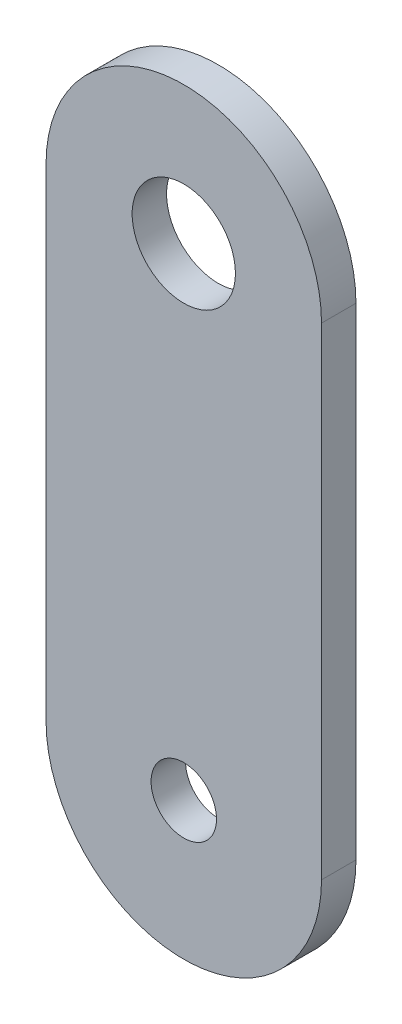
from build123d import *

# Parameters (mm, degrees)
BOSS_EXTRUDE1_DEPTH = 10
SKETCH2_R           = 15
SKETCH2_R_2         = 9.5
CUT_EXTRUDE1_DEPTH  = 10


with BuildPart() as part:
    # Sketch1 → Boss-Extrude1 (new body)
    with BuildSketch(Plane.XY):
        with BuildLine():
            Line((-40, -70), (-40, 70))
            ThreePointArc((-40, 70), (0, 110), (40, 70))
            Line((40, 70), (40, -70))
            ThreePointArc((40, -70), (0, -110), (-40, -70))
        make_face()
    extrude(amount=BOSS_EXTRUDE1_DEPTH)

    # Sketch2 → Cut-Extrude1 (cut)
    with BuildSketch(Plane.XY.offset(10)):
        with Locations((0, 70)):
            Circle(SKETCH2_R)
        with Locations((0, -70)):
            Circle(SKETCH2_R_2)
    extrude(amount=-CUT_EXTRUDE1_DEPTH, mode=Mode.SUBTRACT)


solid = part.part
